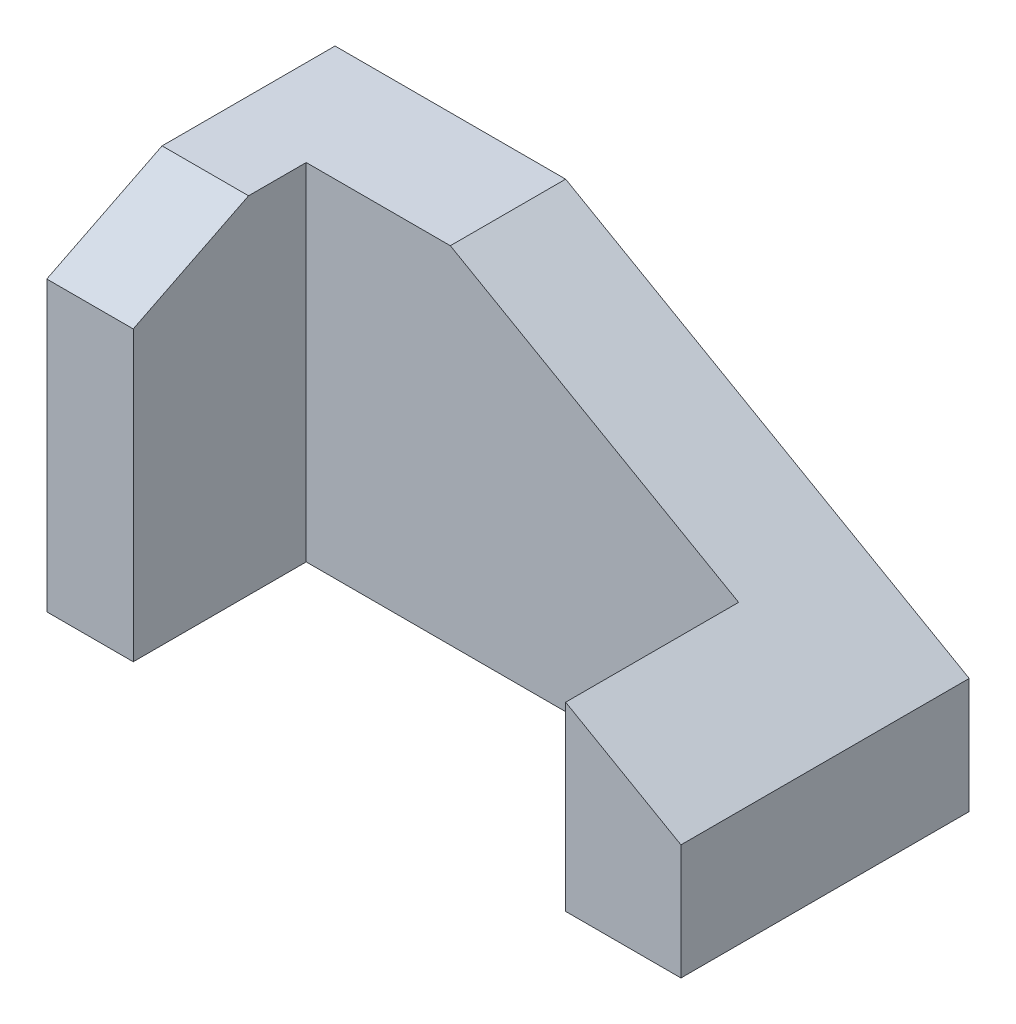
from build123d import *

# Parameters (mm, degrees)
SKETCH_1_W               = 110
SKETCH_1_H               = 50
EXTRUDE_1_DEPTH          = 60
SKETCH_2_W               = 75
SKETCH_2_H               = 30
CUT_EXTRUDE_1_DEPTH      = 135.907375632
CUT_EXTRUDE_2_DEPTH      = 135.907375632
CUT_EXTRUDE_2_DEPTH_BACK = 135.907375632
CUT_EXTRUDE_3_DEPTH      = 123.983738762
CUT_EXTRUDE_3_DEPTH_BACK = 123.983738762


with BuildPart() as part:
    # 스케치1 → 보스-돌출1 (new body)
    with BuildSketch(Plane(origin=(0, 0, 0), x_dir=(1, 0, 0), z_dir=(0, 1, 0))):
        with Locations((55, 25)):
            Rectangle(SKETCH_1_W, SKETCH_1_H)
    extrude(amount=EXTRUDE_1_DEPTH)

    # 스케치2 → 컷-돌출1 (cut, through all)
    with BuildSketch(Plane(origin=(0, 60, 0), x_dir=(1, 0, 0), z_dir=(0, 1, 0))):
        with Locations((52.5, 15)):
            Rectangle(SKETCH_2_W, SKETCH_2_H)
    extrude(amount=-CUT_EXTRUDE_1_DEPTH, mode=Mode.SUBTRACT)

    # 스케치4 → 컷-돌출2 (cut, two sides: drawn at the far end of the back side and taken through both)
    with BuildSketch(Plane.XY.offset(-CUT_EXTRUDE_2_DEPTH_BACK)):
        Polygon((-171.932939983, 181.104537133), (40, 60), (110, 20), (321.932939983, -101.104537133), (564.14201425, 322.761342833), (70.276134283, 604.9704171), align=None)
    extrude(amount=CUT_EXTRUDE_2_DEPTH + CUT_EXTRUDE_2_DEPTH_BACK, mode=Mode.SUBTRACT)

    # 스케치5 → 컷-돌출3 (cut, two sides: drawn at the far end of the back side and taken through both)
    with BuildSketch(Plane(origin=(15, 0, 0), x_dir=(0, 0, -1), z_dir=(1, 0, 0)).offset(-CUT_EXTRUDE_3_DEPTH_BACK)):
        Polygon((155.435378317, 127.717689158), (20, 60), (0, 50), (-135.435378317, -17.717689158), (-270.870756633, 253.153067475), (20, 398.588445792), align=None)
    extrude(amount=CUT_EXTRUDE_3_DEPTH + CUT_EXTRUDE_3_DEPTH_BACK, mode=Mode.SUBTRACT)


solid = part.part
